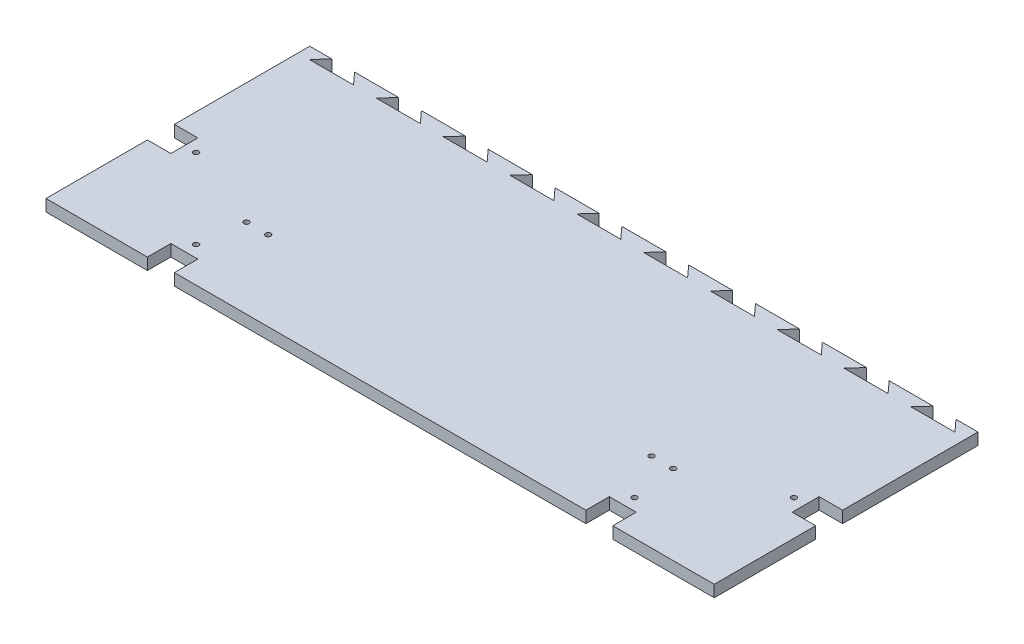
from build123d import *

# Parameters (mm, degrees)
SCHIZZO1_W                   = 570
SCHIZZO1_H                   = 450
ESTRUSIONE_ESTRUSIONE1_DEPTH = 10
SCHIZZO2_R                   = 2.25
SCHIZZO2_W                   = 23
SCHIZZO2_H                   = 20
SCHIZZO2_W_2                 = 20
SCHIZZO2_H_2                 = 23
TAGLIO_ESTRUSIONE1_DEPTH     = 10
TAGLIO_ESTRUSIONE2_DEPTH     = 10


with BuildPart() as part:
    # Schizzo1 → Estrusione-Estrusione1 (new body)
    with BuildSketch(Plane(origin=(0, 0, 0), x_dir=(1, 0, 0), z_dir=(0, 1, 0))):
        with Locations((-285, 225)):
            Rectangle(SCHIZZO1_W, SCHIZZO1_H)
    extrude(amount=ESTRUSIONE_ESTRUSIONE1_DEPTH)

    # Schizzo2 → Taglio-Estrusione1 (cut)
    with BuildSketch(Plane.XZ):
        with Locations(Location((-467, -68, 0), (0, 0, 270))):
            Circle(SCHIZZO2_R)
        with Locations(Location((-448.5, -68, 0), (0, 0, 270))):
            Circle(SCHIZZO2_R)
        with Locations(Location((-121.5, -68, 0), (0, 0, 270))):
            Circle(SCHIZZO2_R)
        with Locations(Location((-103, -68, 0), (0, 0, 270))):
            Circle(SCHIZZO2_R)
        with Locations(Location((-467, -382, 0), (0, 0, 270))):
            Circle(SCHIZZO2_R)
        with Locations(Location((-448.5, -382, 0), (0, 0, 270))):
            Circle(SCHIZZO2_R)
        with Locations(Location((-121.5, -382, 0), (0, 0, 270))):
            Circle(SCHIZZO2_R)
        with Locations(Location((-103, -382, 0), (0, 0, 270))):
            Circle(SCHIZZO2_R)
        with Locations(Location((-472, -420, 0), (0, 0, 270))):
            Circle(SCHIZZO2_R)
        with Locations(Location((-540, -352, 0), (0, 0, 270))):
            Circle(SCHIZZO2_R)
        with Locations(Location((-540, -98, 0), (0, 0, 270))):
            Circle(SCHIZZO2_R)
        with Locations(Location((-472, -30, 0), (0, 0, 270))):
            Circle(SCHIZZO2_R)
        with Locations(Location((-98, -30, 0), (0, 0, 270))):
            Circle(SCHIZZO2_R)
        with Locations(Location((-30, -98, 0), (0, 0, 270))):
            Circle(SCHIZZO2_R)
        with Locations(Location((-30, -352, 0), (0, 0, 270))):
            Circle(SCHIZZO2_R)
        with Locations(Location((-98, -420, 0), (0, 0, 270))):
            Circle(SCHIZZO2_R)
        with Locations((-472, -10)):
            Rectangle(SCHIZZO2_W, SCHIZZO2_H)
        with Locations((-98, -10)):
            Rectangle(SCHIZZO2_W, SCHIZZO2_H)
        with Locations((-10, -98)):
            Rectangle(SCHIZZO2_W_2, SCHIZZO2_H_2)
        with Locations((-10, -352)):
            Rectangle(SCHIZZO2_W_2, SCHIZZO2_H_2)
        with Locations((-98, -440)):
            Rectangle(SCHIZZO2_W, SCHIZZO2_H)
        with Locations((-472, -440)):
            Rectangle(SCHIZZO2_W, SCHIZZO2_H)
        with Locations((-560, -352)):
            Rectangle(SCHIZZO2_W_2, SCHIZZO2_H_2)
        with Locations((-560, -98)):
            Rectangle(SCHIZZO2_W_2, SCHIZZO2_H_2)
    extrude(amount=-TAGLIO_ESTRUSIONE1_DEPTH, mode=Mode.SUBTRACT)

    # Schizzo3 → Taglio-Estrusione2 (cut)
    with BuildSketch(Plane.XZ):
        Polygon((-570, -225), (-551.2, -225), (-560.3, -215), (-522.7, -215), (-531.8, -225), (-513, -225), (-494.2, -225), (-503.3, -215), (-465.7, -215), (-474.8, -225), (-456, -225), (-437.2, -225), (-446.3, -215), (-408.7, -215), (-417.8, -225), (-399, -225), (-380.2, -225), (-389.3, -215), (-351.7, -215), (-360.8, -225), (-342, -225), (-323.2, -225), (-332.3, -215), (-294.7, -215), (-303.8, -225), (-285, -225), (-266.2, -225), (-275.3, -215), (-237.7, -215), (-246.8, -225), (-228, -225), (-209.2, -225), (-218.3, -215), (-180.7, -215), (-189.8, -225), (-171, -225), (-152.2, -225), (-161.3, -215), (-123.7, -215), (-132.8, -225), (-114, -225), (-95.2, -225), (-104.3, -215), (-66.7, -215), (-75.8, -225), (-57, -225), (-38.2, -225), (-47.3, -215), (-9.7, -215), (-18.8, -225), (0, -225), (0, -450), (-570, -450), align=None)
    extrude(amount=-TAGLIO_ESTRUSIONE2_DEPTH, mode=Mode.SUBTRACT)


solid = part.part
